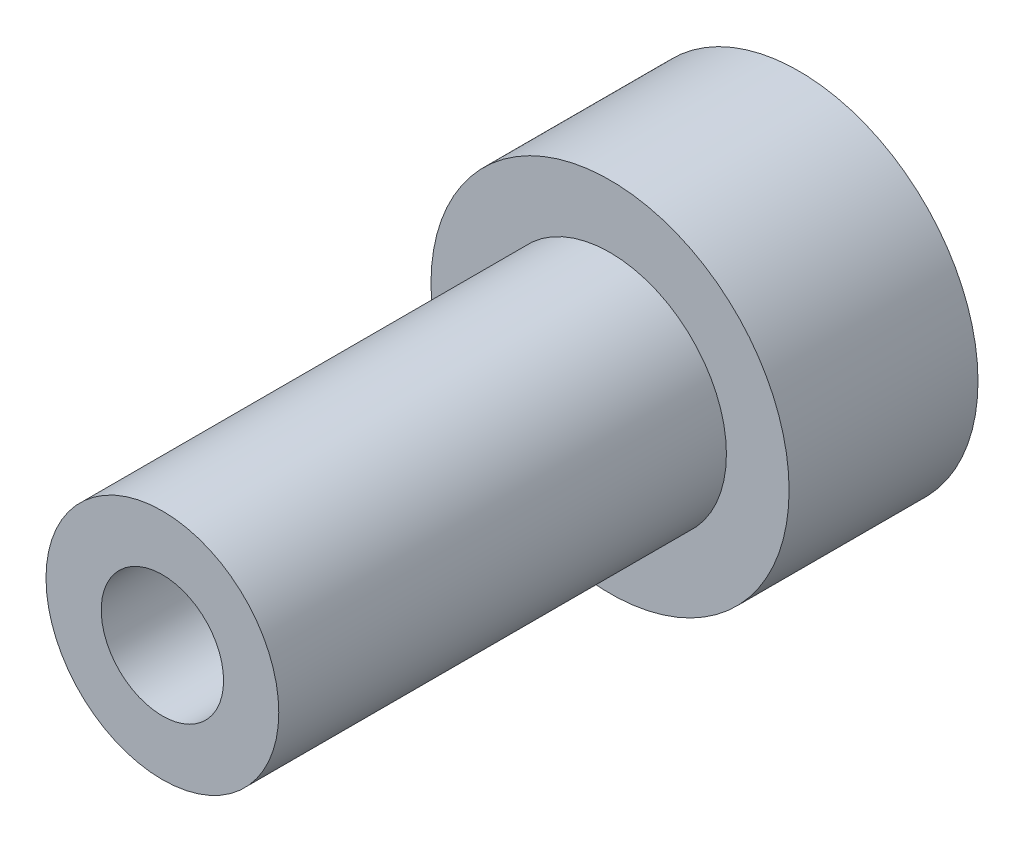
from build123d import *

# Parameters (mm, degrees)
SKETCH1_R           = 6
SKETCH1_R_2         = 2.05
BOSS_EXTRUDE1_DEPTH = 6.33
SKETCH2_R           = 3.9
SKETCH2_R_2         = 2.05
BOSS_EXTRUDE2_DEPTH = 15


with BuildPart() as part:
    # Sketch1 → Boss-Extrude1 (new body)
    with BuildSketch(Plane.XY):
        Circle(SKETCH1_R)
        Circle(SKETCH1_R_2, mode=Mode.SUBTRACT)
    extrude(amount=BOSS_EXTRUDE1_DEPTH)

    # Sketch2 → Boss-Extrude2 (add)
    with BuildSketch(Plane.XY.offset(6.33)):
        Circle(SKETCH2_R)
        Circle(SKETCH2_R_2, mode=Mode.SUBTRACT)
    extrude(amount=BOSS_EXTRUDE2_DEPTH)


solid = part.part
